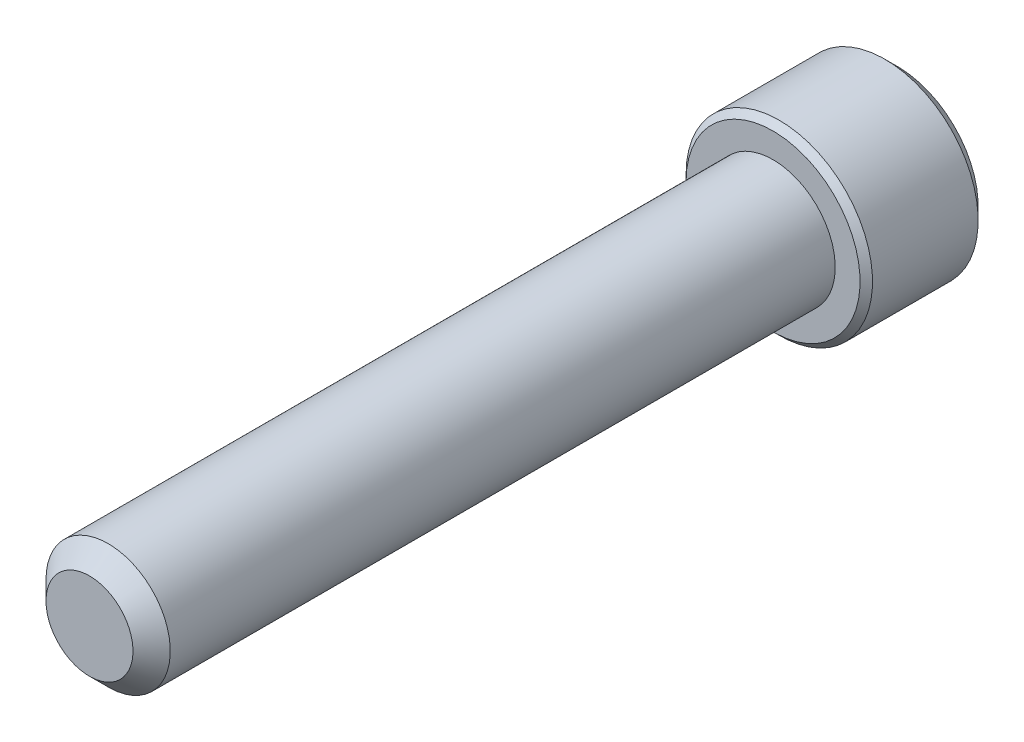
from build123d import *

# Parameters (mm, degrees)
SKETCH1_R          = 3.175
EXTRUDE1_DEPTH     = 34.925
CHAMFER3_SIZE      = 0.9525
SKETCH6_R          = 4.7625
EXTRUDE2_DEPTH     = 6.35
CUT_EXTRUDE1_DEPTH = 3.571875
SKETCH8_R          = 2.749630657
CUT_EXTRUDE2_DEPTH = 0.635
CUT_EXTRUDE2_DRAFT = -45
CHAMFER1_SIZE      = 0.635
CHAMFER2_SIZE      = 0.3175


with BuildPart() as part:
    # Sketch1 → Extrude1 (new body)
    with BuildSketch(Plane.XY):
        Circle(SKETCH1_R)
    extrude(amount=-EXTRUDE1_DEPTH)

    # Chamfer3
    chamfer3_edges = [part.edges().sort_by_distance(p)[0] for p in [
        (-3.175, 0, 0),
    ]]
    chamfer(chamfer3_edges, length=CHAMFER3_SIZE)

    # Sketch6 → Extrude2 (add)
    with BuildSketch(Plane(origin=(0, 0, -34.925), x_dir=(-1, 0, 0), z_dir=(0, 0, -1))):
        Circle(SKETCH6_R)
    extrude(amount=EXTRUDE2_DEPTH)

    # Sketch7 → Cut-Extrude1 (cut)
    with BuildSketch(Plane(origin=(0, 0, -41.275), x_dir=(-1, 0, 0), z_dir=(0, 0, -1))):
        Polygon((0, 2.749630657), (-2.38125, 1.374815329), (-2.38125, -1.374815329), (0, -2.749630657), (2.38125, -1.374815329), (2.38125, 1.374815329), align=None)
    extrude(amount=-CUT_EXTRUDE1_DEPTH, mode=Mode.SUBTRACT)


with BuildPart() as cut_extrude2_tool:
    # Sketch8 → Cut-Extrude2 (with draft: the straight prism first)
    with BuildSketch(Plane(origin=(0, 0, -41.275), x_dir=(-1, 0, 0), z_dir=(0, 0, -1))):
        Circle(SKETCH8_R)
    extrude(amount=-CUT_EXTRUDE2_DEPTH)
    # Cut-Extrude2: the draft: its side faces are tilted about the plane it starts from
    cut_extrude2_sides = [cut_extrude2_tool.faces().sort_by_distance(p)[0] for p in [
        (2.749630657, 0, -40.9575),
    ]]
    draft(cut_extrude2_sides, Plane(origin=(0, 0, -41.275), x_dir=(-1, 0, 0), z_dir=(0, 0, -1)), CUT_EXTRUDE2_DRAFT)


with BuildPart() as part_1:
    add(part.part)

    # Cut-Extrude2: cut by cut_extrude2_tool
    add(cut_extrude2_tool.part, mode=Mode.SUBTRACT)

    # Chamfer1
    chamfer1_edges = [part_1.edges().sort_by_distance(p)[0] for p in [
        (4.7625, 0, -41.275),
    ]]
    chamfer(chamfer1_edges, length=CHAMFER1_SIZE)

    # Chamfer2
    chamfer2_edges = [part_1.edges().sort_by_distance(p)[0] for p in [
        (4.7625, 0, -34.925),
    ]]
    chamfer(chamfer2_edges, length=CHAMFER2_SIZE)


solid = part_1.part
